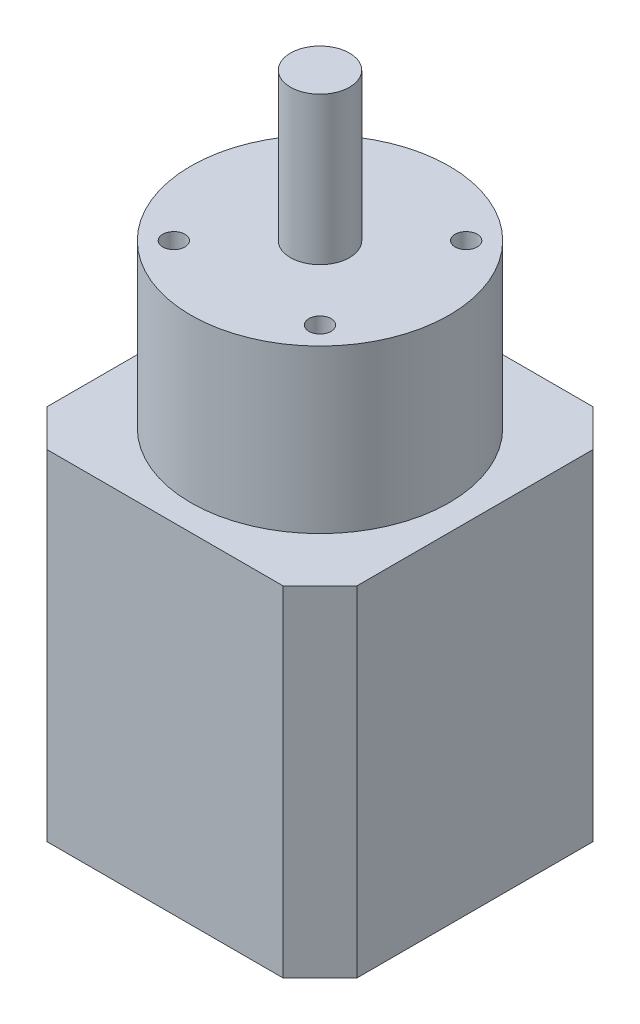
from build123d import *

# Parameters (mm, degrees)
SKETCH1_W           = 42
SKETCH1_H           = 42
BOSS_EXTRUDE1_DEPTH = 46
CHAMFER1_SIZE       = 5
SKETCH5_R           = 17.5
BOSS_EXTRUDE4_DEPTH = 22
SKETCH6_R           = 4
BOSS_EXTRUDE5_DEPTH = 20
SKETCH7_R           = 1.5
CUT_EXTRUDE2_DEPTH  = 5


with BuildPart() as part:
    # Sketch1 → Boss-Extrude1 (new body)
    with BuildSketch(Plane(origin=(0, 0, 0), x_dir=(1, 0, 0), z_dir=(0, 1, 0))):
        Rectangle(SKETCH1_W, SKETCH1_H)
    extrude(amount=BOSS_EXTRUDE1_DEPTH)

    # Chamfer1
    chamfer1_edges = [part.edges().sort_by_distance(p)[0] for p in [
        (21, 23, 21),
        (-21, 23, 21),
        (-21, 23, -21),
        (21, 23, -21),
    ]]
    chamfer(chamfer1_edges, length=CHAMFER1_SIZE)

    # Sketch5 → Boss-Extrude4 (add)
    with BuildSketch(Plane(origin=(0, 46, 0), x_dir=(1, 0, 0), z_dir=(0, 1, 0))):
        with Locations(Location((0, 0, 0), (0, 0, 90))):
            Circle(SKETCH5_R)
    extrude(amount=BOSS_EXTRUDE4_DEPTH)

    # Sketch6 → Boss-Extrude5 (add)
    with BuildSketch(Plane(origin=(0, 68, 0), x_dir=(1, 0, 0), z_dir=(0, 1, 0))):
        with Locations(Location((0, 0, 0), (0, 0, 270))):
            Circle(SKETCH6_R)
    extrude(amount=BOSS_EXTRUDE5_DEPTH)

    # Sketch7 → Cut-Extrude2 (cut)
    with BuildSketch(Plane(origin=(0, 68, 0), x_dir=(1, 0, 0), z_dir=(0, 1, 0))):
        with Locations(Location((-9.899494937, 9.899494937, 0), (0, 0, 270))):
            Circle(SKETCH7_R)
        with Locations(Location((9.899494937, 9.899494937, 0), (0, 0, 270))):
            Circle(SKETCH7_R)
        with Locations(Location((9.899494937, -9.899494937, 0), (0, 0, 270))):
            Circle(SKETCH7_R)
        with Locations(Location((-9.899494937, -9.899494937, 0), (0, 0, 270))):
            Circle(SKETCH7_R)
    extrude(amount=-CUT_EXTRUDE2_DEPTH, mode=Mode.SUBTRACT)


solid = part.part
